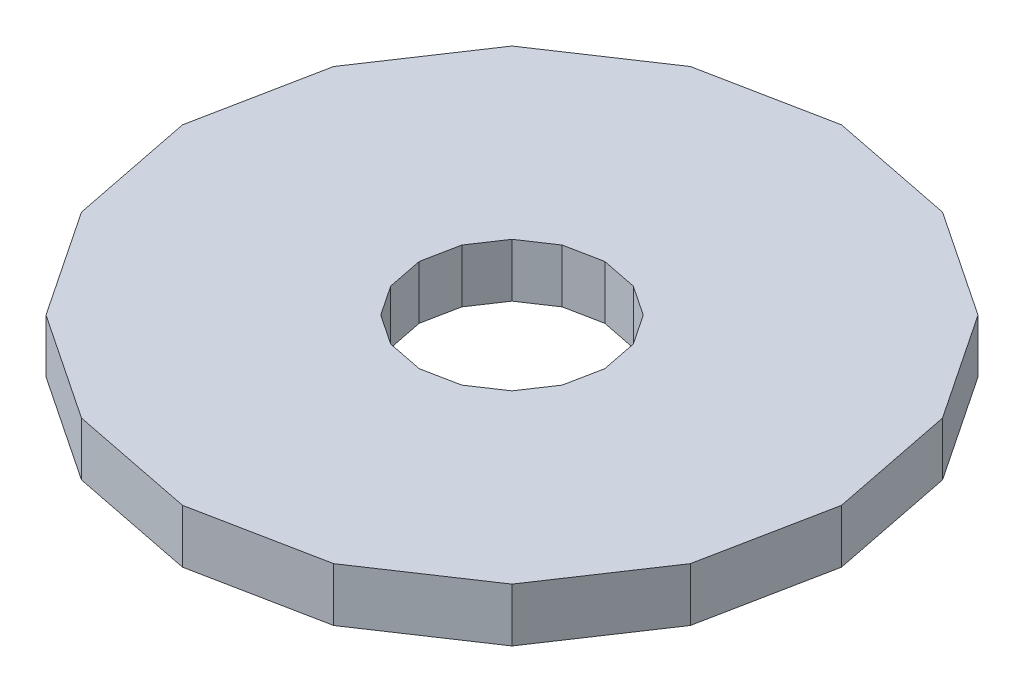
from build123d import *

# Parameters (mm, degrees)
BOSS_EXTRUDE1_DEPTH = 19.05


with BuildPart() as part:
    # Sketch1 → Boss-Extrude1 (new body)
    with BuildSketch(Plane(origin=(0, 0, 0), x_dir=(1, 0, 0), z_dir=(0, 1, 0))):
        Polygon((117.176494271, 0), (108.256964748, 44.84150302), (82.856293695, 82.856293695), (44.84150302, 108.256964748), (0, 117.176494271), (-44.84150302, 108.256964748), (-82.856293695, 82.856293695), (-108.256964748, 44.84150302), (-117.176494271, 0), (-108.256964748, -44.84150302), (-82.856293695, -82.856293695), (-44.84150302, -108.256964748), (0, -117.176494271), (44.84150302, -108.256964748), (82.856293695, -82.856293695), (108.256964748, -44.84150302), align=None)
        Polygon((33.009244161, 0), (30.496565064, 12.632090855), (23.341060388, 23.341060388), (12.632090855, 30.496565064), (0, 33.009244161), (-12.632090855, 30.496565064), (-23.341060388, 23.341060388), (-30.496565064, 12.632090855), (-33.009244161, 0), (-30.496565064, -12.632090855), (-23.341060388, -23.341060388), (-12.632090855, -30.496565064), (0, -33.009244161), (12.632090855, -30.496565064), (23.341060388, -23.341060388), (30.496565064, -12.632090855), align=None, mode=Mode.SUBTRACT)
    extrude(amount=BOSS_EXTRUDE1_DEPTH)


solid = part.part
